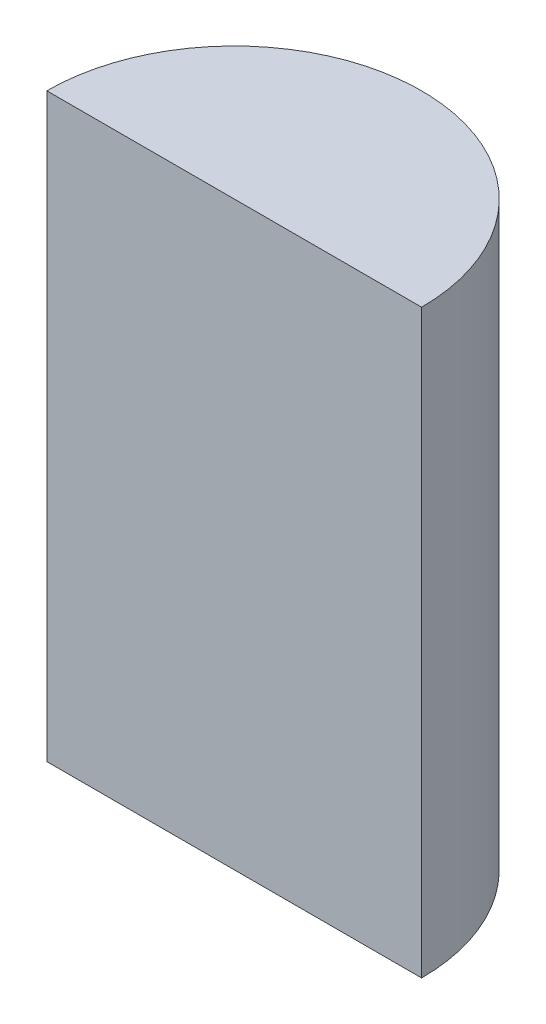
from build123d import *

# Parameters (mm, degrees)
BOSS_EXTRUDE1_DEPTH = 31


with BuildPart() as part:
    # Sketch1 → Boss-Extrude1 (new body)
    with BuildSketch(Plane(origin=(0, 0, 0), x_dir=(1, 0, 0), z_dir=(0, 1, 0))):
        with BuildLine():
            Line((-10, 0), (10, 0))
            ThreePointArc((10, 0), (0, 10), (-10, 0))
        make_face()
    extrude(amount=BOSS_EXTRUDE1_DEPTH)


solid = part.part
